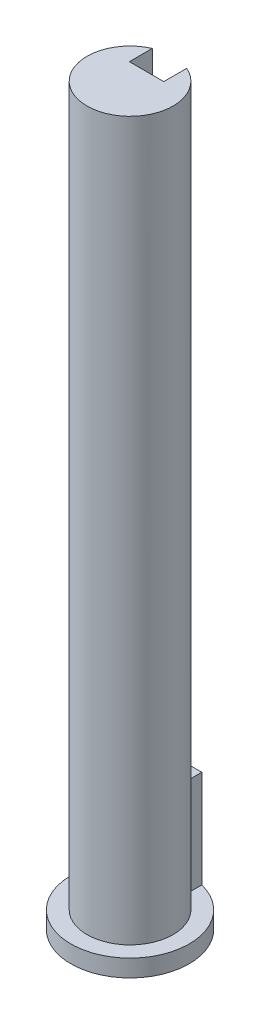
from build123d import *

# Parameters (mm, degrees)
EXTRUDE_2_DEPTH     = 50
EXTRUDE_3_DEPTH     = 6.8
CUT_EXTRUDE_1_DEPTH = 37.2
SKETCH_3_R          = 4.123105626
EXTRUDE_4_DEPTH     = 1.2


with BuildPart() as part:
    # 스케치1 → 보스-돌출2 (new body)
    with BuildSketch(Plane(origin=(0, 0, 0), x_dir=(1, 0, 0), z_dir=(0, 1, 0))):
        with BuildLine():
            ThreePointArc((1, 2.828427125), (0, 3), (-1, 2.828427125))
            ThreePointArc((-1, 2.828427125), (-1.732050808, -2.449489743), (3, 0))
            ThreePointArc((3, 0), (2.449489743, 1.732050808), (1, 2.828427125))
        make_face()
    extrude(amount=EXTRUDE_2_DEPTH)

    # 스케치1<3> → 보스-돌출3 (add)
    with BuildSketch(Plane(origin=(0, 0, 0), x_dir=(1, 0, 0), z_dir=(0, 1, 0))):
        with BuildLine():
            Line((-1, 4), (-1, 2.828427125))
            ThreePointArc((-1, 2.828427125), (0, 3), (1, 2.828427125))
            Line((1, 2.828427125), (1, 4))
            Line((1, 4), (-1, 4))
        make_face()
    extrude(amount=EXTRUDE_3_DEPTH)

    # 스케치2 → 컷-돌출1 (cut)
    with BuildSketch(Plane(origin=(0, 50, 0), x_dir=(1, 0, 0), z_dir=(0, 1, 0))):
        Polygon((-1.2, 1.149545417), (1.2, 1.149545417), (1.2, 2.749545417), (0, 4.828006386), (-1.2, 2.749545417), align=None)
    extrude(amount=-CUT_EXTRUDE_1_DEPTH, mode=Mode.SUBTRACT)

    # 스케치3 → 보스-돌출4 (add)
    with BuildSketch(Plane.XZ):
        Circle(SKETCH_3_R)
    extrude(amount=EXTRUDE_4_DEPTH)


solid = part.part
